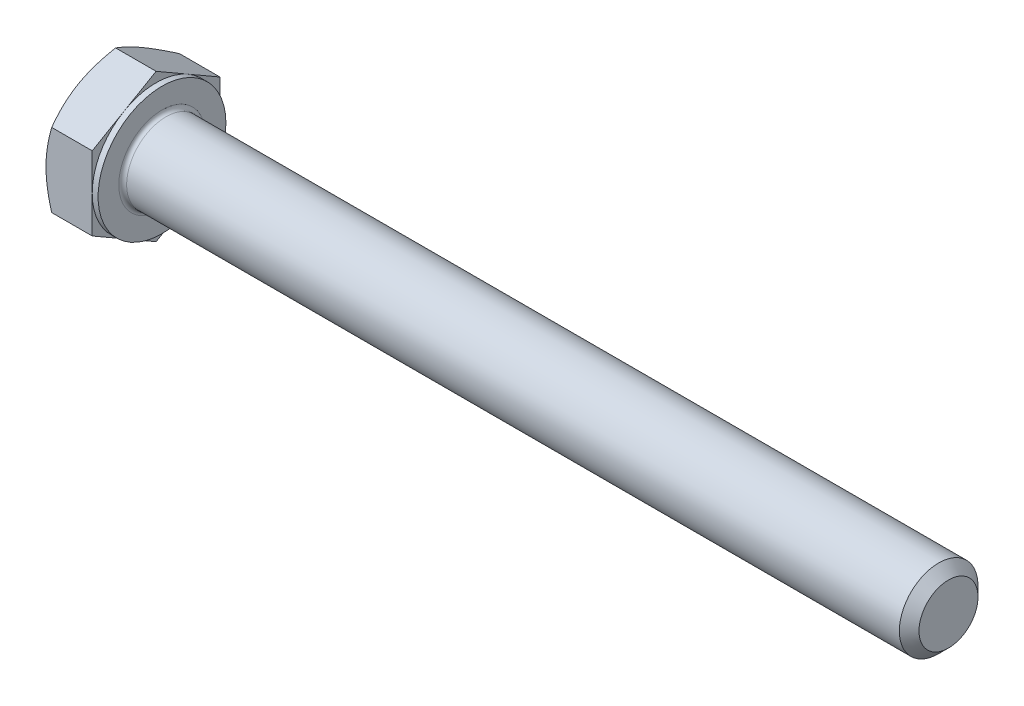
from build123d import *

# Parameters (mm, degrees)
EXTRUDE_370_DEPTH = 5.3
SKETCH_4_W        = 0.6
SKETCH_4_H        = 11.005553499
CHAMFER_2030_SIZE = 1
FILLET_2072_R     = 0.4


with BuildPart() as part:
    # 草图1 → Extrude 370 (new body)
    with BuildSketch(Plane(origin=(0, 0, 0), x_dir=(0, 0, -1), z_dir=(1, 0, 0))):
        Polygon((6.5, 3.75277675), (6.5, -3.75277675), (0, -7.505553499), (-6.5, -3.75277675), (-6.5, 3.75277675), (0, 7.505553499), align=None)
    extrude(amount=EXTRUDE_370_DEPTH)

    # 草图2 → 凸台-旋转1 (revolve)
    with BuildSketch(Plane.XY, mode=Mode.PRIVATE) as revolve_1_sk:
        Polygon((0, 0), (85.3, 0), (85.3, 2.9175), (85.3, 4), (27.8072, 4), (0, 4), align=None)
    revolve(revolve_1_sk.sketch.rotate(Axis((0, 0, 0), (1, 0, 0)), 90), axis=Axis((0, 0, 0), (1, 0, 0)))

    # 草图3 → 切除-旋转1 (revolve, cut)
    with BuildSketch(Plane.XY):
        Polygon((0, 6.5), (3.46730793, 12.505553499), (3.46730793, 17.505553499), (-10, 17.505553499), (-10, 6.5), align=None)
    revolve(axis=Axis((0, 0, 0), (1, 0, 0)), mode=Mode.SUBTRACT)

    # 草图5 → 切除-旋转2 (revolve, cut)
    with BuildSketch(Plane.XY):
        Polygon((5.3, 6.5), (1.83269207, 12.505553499), (1.83269207, 17.505553499), (11.83269207, 17.505553499), (11.83269207, 6.5), align=None)
    revolve(axis=Axis((0, 0, 0), (1, 0, 0)), mode=Mode.SUBTRACT)

    # 草图4 → 切除-旋转3 (revolve, cut)
    with BuildSketch(Plane.XY, mode=Mode.PRIVATE) as cut_revolve_3_sk:
        with Locations((5, 12.00277675)):
            Rectangle(SKETCH_4_W, SKETCH_4_H)
    revolve(cut_revolve_3_sk.sketch.rotate(Axis((0, 0, 0), (1, 0, 0)), 270), axis=Axis((0, 0, 0), (1, 0, 0)), mode=Mode.SUBTRACT)

    # Chamfer 2030
    chamfer_2030_edges = [part.edges().sort_by_distance(p)[0] for p in [
        (85.3, 0, -4),
    ]]
    chamfer(chamfer_2030_edges, length=CHAMFER_2030_SIZE)

    # Fillet 2072
    fillet_2072_edges = [part.edges().sort_by_distance(p)[0] for p in [
        (5.3, 0, -4),
    ]]
    fillet(fillet_2072_edges, radius=FILLET_2072_R)


solid = part.part
